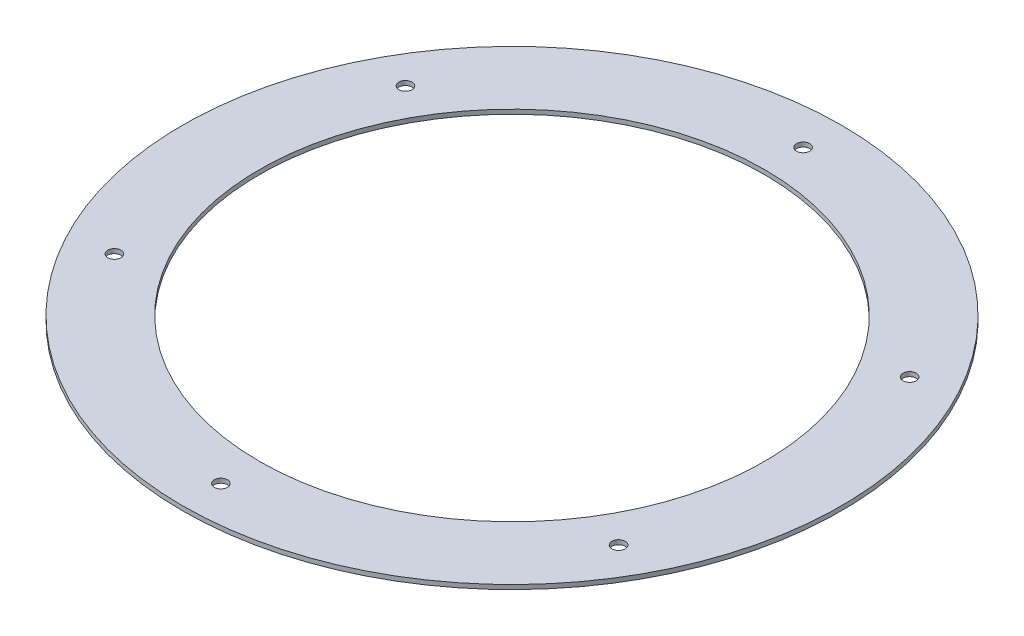
from build123d import *

# Parameters (mm, degrees)
SKETCH1_R           = 150
SKETCH1_R_2         = 115
SKETCH1_R_3         = 3
BOSS_EXTRUDE1_DEPTH = 2


with BuildPart() as part:
    # Sketch1 → Boss-Extrude1 (new body)
    with BuildSketch(Plane(origin=(0, 0, 0), x_dir=(1, 0, 0), z_dir=(0, 1, 0))):
        with Locations(Location((0, 0, 0), (0, 0, 270))):
            Circle(SKETCH1_R)
        with Locations(Location((0, 0, 0), (0, 0, 270))):
            Circle(SKETCH1_R_2, mode=Mode.SUBTRACT)
        with Locations(Location((0, 132.5, 0), (0, 0, 270))):
            Circle(SKETCH1_R_3, mode=Mode.SUBTRACT)
        with Locations(Location((114.748366001, 66.25, 0), (0, 0, 270))):
            Circle(SKETCH1_R_3, mode=Mode.SUBTRACT)
        with Locations(Location((114.748366001, -66.25, 0), (0, 0, 270))):
            Circle(SKETCH1_R_3, mode=Mode.SUBTRACT)
        with Locations(Location((0, -132.5, 0), (0, 0, 270))):
            Circle(SKETCH1_R_3, mode=Mode.SUBTRACT)
        with Locations(Location((-114.748366001, -66.25, 0), (0, 0, 270))):
            Circle(SKETCH1_R_3, mode=Mode.SUBTRACT)
        with Locations(Location((-114.748366001, 66.25, 0), (0, 0, 270))):
            Circle(SKETCH1_R_3, mode=Mode.SUBTRACT)
    extrude(amount=BOSS_EXTRUDE1_DEPTH)


solid = part.part
